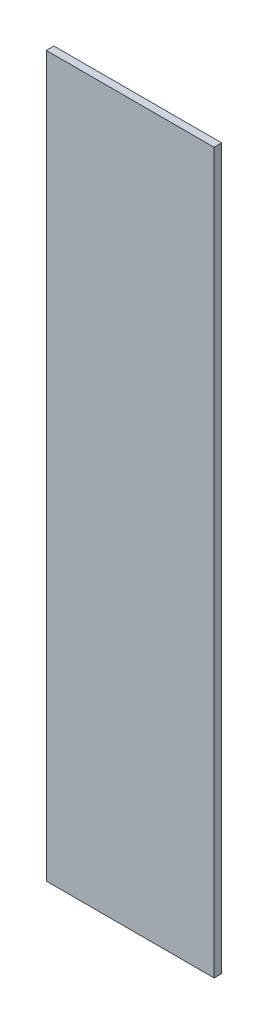
from build123d import *

# Parameters (mm, degrees)
BOSS_EXTRUDE1_DEPTH      = 12.7
BOSS_EXTRUDE1_DEPTH_BACK = 12.7
SKETCH1_W                = 560
SKETCH1_H                = 2400


with BuildPart() as part:
    # Sketch1 → Boss-Extrude1 (new, two sides: drawn at the far end of the back side and taken through both)
    with BuildSketch(Plane.XY.offset(-BOSS_EXTRUDE1_DEPTH_BACK)):
        with Locations((1110.493140497, 132.044896921)):
            Rectangle(SKETCH1_W, SKETCH1_H)
    extrude(amount=BOSS_EXTRUDE1_DEPTH + BOSS_EXTRUDE1_DEPTH_BACK)


solid = part.part
